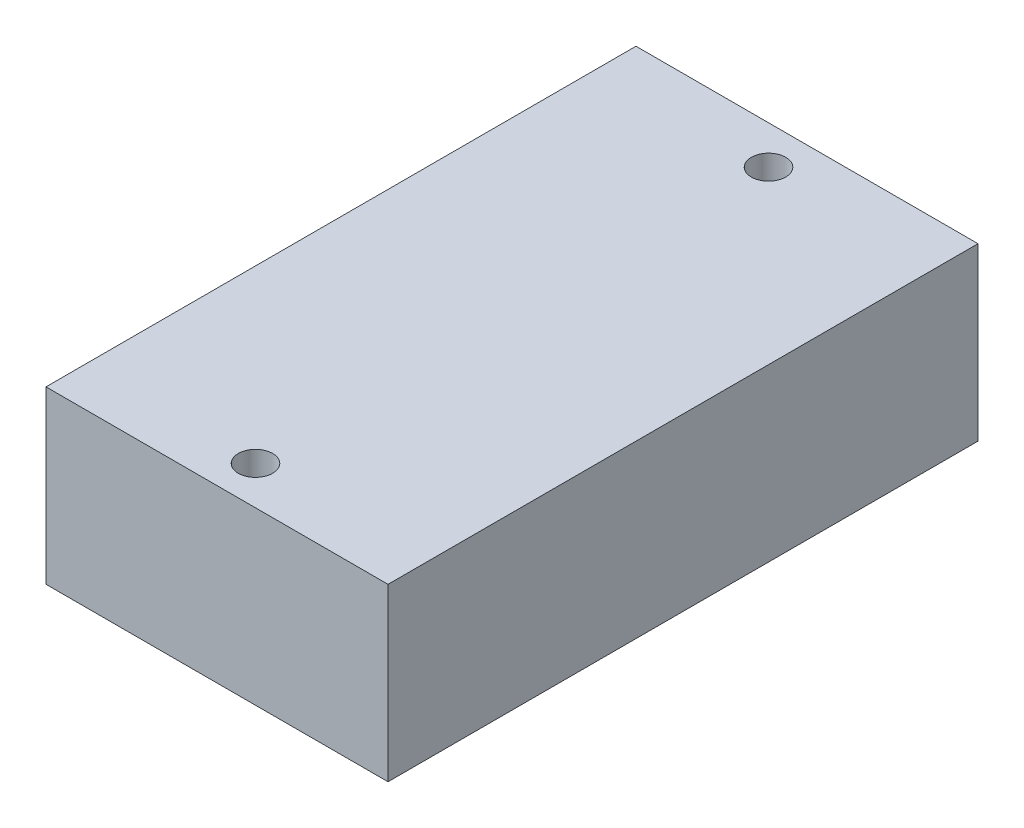
from build123d import *

# Parameters (mm, degrees)
SKETCH1_W              = 50.8
SKETCH1_H              = 87.63
BOSS_EXTRUDE1_DEPTH    = 25.4
F_10_CLEARANCE_HOLE1_D = 5.1054


with BuildPart() as part:
    # Sketch1 → Boss-Extrude1 (new body)
    with BuildSketch(Plane(origin=(0, 0, 0), x_dir=(1, 0, 0), z_dir=(0, 1, 0))):
        Rectangle(SKETCH1_W, SKETCH1_H)
    extrude(amount=BOSS_EXTRUDE1_DEPTH)

    # #10 Clearance Hole1 (through all)
    with Locations(Plane(origin=(0, 25.4, 0), x_dir=(1, 0, 0), z_dir=(0, 1, 0))):
        with Locations((0, -38.1), (0, 38.1)):
            Hole(F_10_CLEARANCE_HOLE1_D / 2)


solid = part.part
